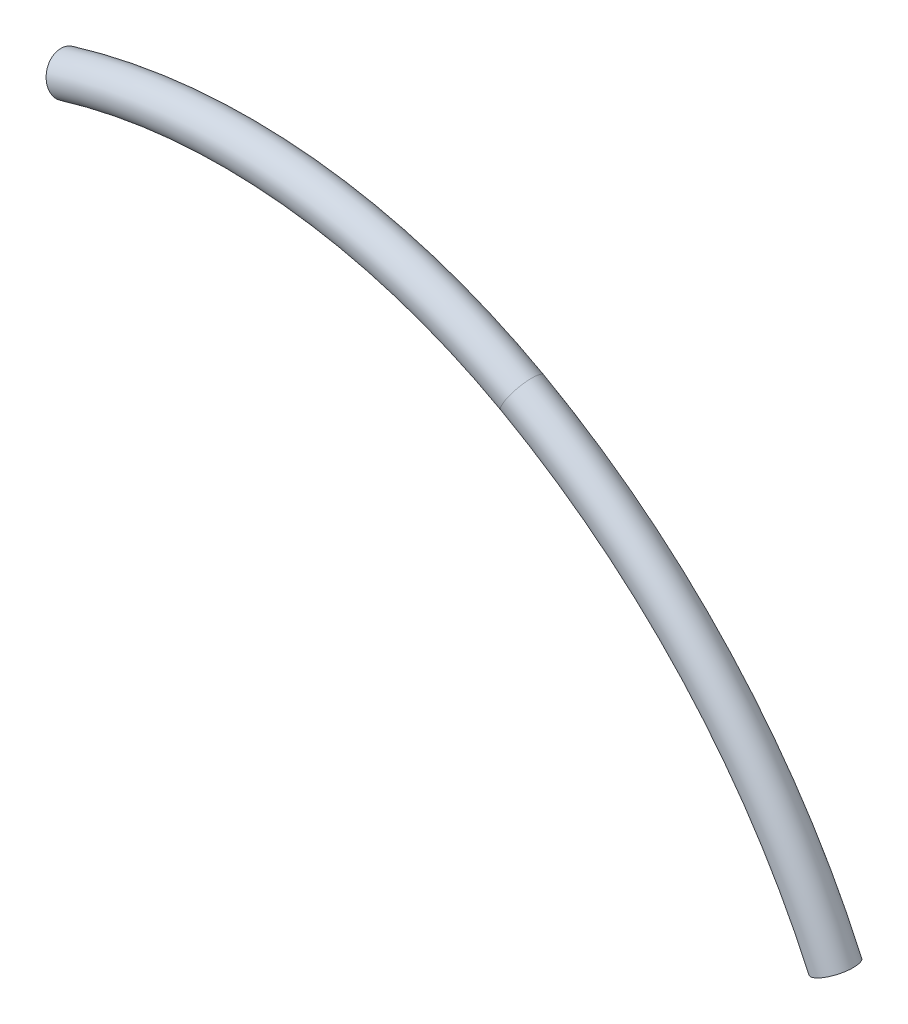
from build123d import *

# Parameters (mm, degrees)
SKETCH2_R = 50.8


with BuildPart() as part:
    # Sweep1: sweep along a path in Sketch1
    with BuildLine(Plane.XY) as sweep1_path:
        ThreePointArc((4111.746389716, -1077.947055764), (3777.731613312, -571.12450839), (3300.921138207, -195.509364642))
        ThreePointArc((3300.921138207, -195.509364642), (2723.584616597, -12.910182438), (2120.770120359, -70.13433514))
    # Sketch2 → Sweep1 (sweep)
    with BuildSketch(Plane(origin=(1093.601808152, -2434.004091071, 0), x_dir=(-0.9121597666914735, -0.40983479602073425, 0), z_dir=(-0.40983479602073425, 0.9121597666914735, 0))):
        with Locations((-3308.789415818, 0)):
            Circle(SKETCH2_R)
    sweep(path=sweep1_path.line)


solid = part.part
